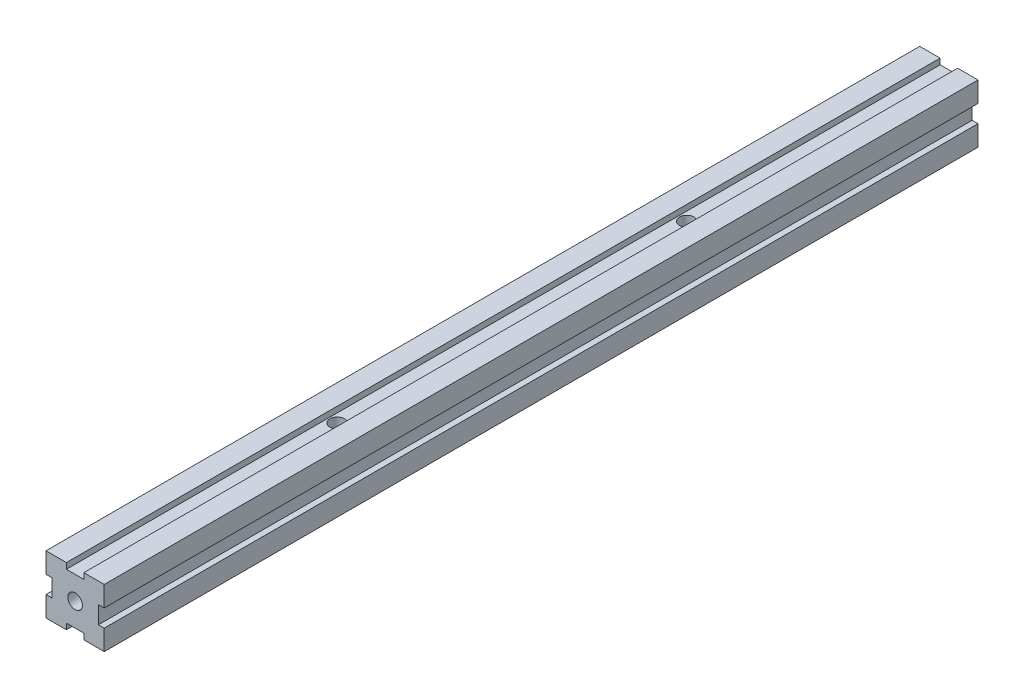
from build123d import *

# Parameters (mm, degrees)
SKETCH_1_R          = 2.5
EXTRUDE_1_DEPTH     = 300
SKETCH_2_R          = 2.5
CUT_EXTRUDE_1_DEPTH = 302.330383466


with BuildPart() as part:
    # 草图1 → 凸台-拉伸1 (new body)
    with BuildSketch(Plane.XY):
        Polygon((0, -13), (0, -20), (7, -20), (7, -18), (13, -18), (13, -20), (20, -20), (20, -13), (18, -13), (18, -7), (20, -7), (20, 0), (13, 0), (13, -2), (7, -2), (7, 0), (0, 0), (0, -7), (2, -7), (2, -13), align=None)
        with Locations((10, -10)):
            Circle(SKETCH_1_R, mode=Mode.SUBTRACT)
    extrude(amount=EXTRUDE_1_DEPTH)

    # 草图2 → 切除-拉伸1 (cut, through all)
    with BuildSketch(Plane(origin=(0, 0, 0), x_dir=(1, 0, 0), z_dir=(0, 1, 0))):
        with Locations(Location((10, -90, 0), (0, 0, 270))):
            Circle(SKETCH_2_R)
        with Locations(Location((10, -210, 0), (0, 0, 270))):
            Circle(SKETCH_2_R)
    extrude(amount=-CUT_EXTRUDE_1_DEPTH, mode=Mode.SUBTRACT)


solid = part.part
